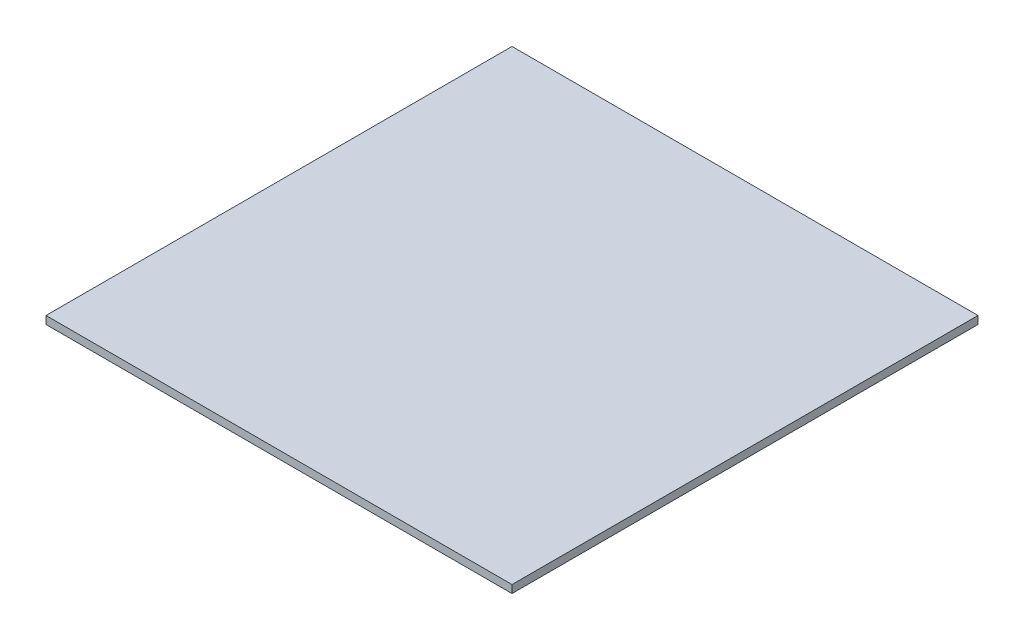
from build123d import *

# Parameters (mm, degrees)
SKETCH1_W           = 595
SKETCH1_H           = 595
BOSS_EXTRUDE1_DEPTH = 10


with BuildPart() as part:
    # Sketch1 → Boss-Extrude1 (new body)
    with BuildSketch(Plane(origin=(0, 0, 0), x_dir=(1, 0, 0), z_dir=(0, 1, 0))):
        Rectangle(SKETCH1_W, SKETCH1_H)
    extrude(amount=BOSS_EXTRUDE1_DEPTH)


solid = part.part
